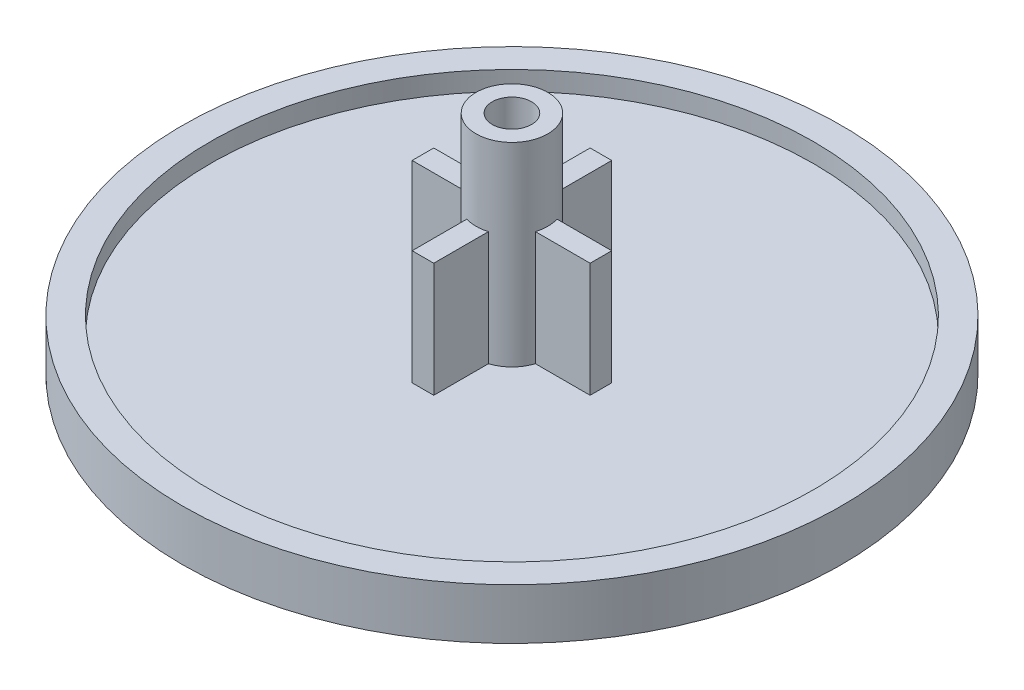
from build123d import *

# Parameters (mm, degrees)
SKETCH1_R           = 13.1699
BOSS_EXTRUDE1_DEPTH = 1.27
SKETCH2_R           = 13.1699
SKETCH2_R_2         = 12.0523
BOSS_EXTRUDE2_DEPTH = 0.762
SKETCH3_R           = 1.4351
BOSS_EXTRUDE3_DEPTH = 7.7724
SKETCH6_W           = 7.112
SKETCH6_H           = 5.842
BOSS_EXTRUDE4_DEPTH = 0.4318
SKETCH7_W           = 7.112
SKETCH7_H           = 5.842
BOSS_EXTRUDE5_DEPTH = 0.4318
SKETCH4_R           = 0.7874
CUT_EXTRUDE1_DEPTH  = 7.7724


with BuildPart() as part:
    # Sketch1 → Boss-Extrude1 (new body)
    with BuildSketch(Plane(origin=(0, 0, 0), x_dir=(1, 0, 0), z_dir=(0, 1, 0))):
        with Locations(Location((0, 0, 0), (0, 0, 270))):
            Circle(SKETCH1_R)
    extrude(amount=BOSS_EXTRUDE1_DEPTH)

    # Sketch2 → Boss-Extrude2 (add)
    with BuildSketch(Plane(origin=(0, 1.27, 0), x_dir=(1, 0, 0), z_dir=(0, 1, 0))):
        with Locations(Location((0, 0, 0), (0, 0, 270))):
            Circle(SKETCH2_R)
        with Locations(Location((0, 0, 0), (0, 0, 90))):
            Circle(SKETCH2_R_2, mode=Mode.SUBTRACT)
    extrude(amount=BOSS_EXTRUDE2_DEPTH)

    # Sketch3 → Boss-Extrude3 (add)
    with BuildSketch(Plane(origin=(0, 1.27, 0), x_dir=(1, 0, 0), z_dir=(0, 1, 0))):
        with Locations(Location((0, 0, 0), (0, 0, 90))):
            Circle(SKETCH3_R)
    extrude(amount=BOSS_EXTRUDE3_DEPTH)

    # Sketch6 → Boss-Extrude4 (add, symmetric)
    with BuildSketch(Plane.XY):
        with Locations((0, 2.921)):
            Rectangle(SKETCH6_W, SKETCH6_H)
    extrude(amount=BOSS_EXTRUDE4_DEPTH, both=True)

    # Sketch7 → Boss-Extrude5 (add, symmetric)
    with BuildSketch(Plane(origin=(0, 0, 0), x_dir=(0, 0, -1), z_dir=(1, 0, 0))):
        with Locations((0, 2.921)):
            Rectangle(SKETCH7_W, SKETCH7_H)
    extrude(amount=BOSS_EXTRUDE5_DEPTH, both=True)

    # Sketch4 → Cut-Extrude1 (cut)
    with BuildSketch(Plane(origin=(0, 9.0424, 0), x_dir=(1, 0, 0), z_dir=(0, 1, 0))):
        with Locations(Location((0, 0, 0), (0, 0, 270))):
            Circle(SKETCH4_R)
    extrude(amount=-CUT_EXTRUDE1_DEPTH, mode=Mode.SUBTRACT)


solid = part.part
